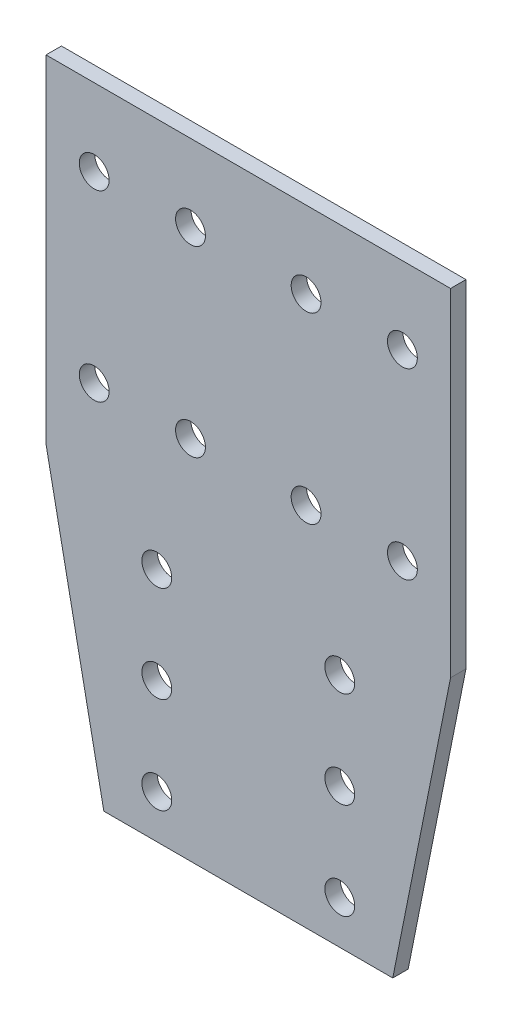
from build123d import *

# Parameters (mm, degrees)
SKETCH_1_R      = 15.5
EXTRUDE_1_DEPTH = 16


with BuildPart() as part:
    # 草图1 → 拉伸1 (new body)
    with BuildSketch(Plane.XY):
        Polygon((380.780090503, 350), (-39.219909497, 350), (-39.219909497, 0), (20.780090503, -300), (320.780090503, -300), (380.780090503, 0), align=None)
        with Locations((75.780090503, -255)):
            Circle(SKETCH_1_R, mode=Mode.SUBTRACT)
        with Locations((75.780090503, -55)):
            Circle(SKETCH_1_R, mode=Mode.SUBTRACT)
        with Locations((75.780090503, -155)):
            Circle(SKETCH_1_R, mode=Mode.SUBTRACT)
        with Locations((110.780090503, 80)):
            Circle(SKETCH_1_R, mode=Mode.SUBTRACT)
        with Locations((10.780090503, 80)):
            Circle(SKETCH_1_R, mode=Mode.SUBTRACT)
        with Locations(Location((110.780090503, 270, 0), (0, 0, 180))):
            Circle(SKETCH_1_R, mode=Mode.SUBTRACT)
        with Locations(Location((10.780090503, 270, 0), (0, 0, 180))):
            Circle(SKETCH_1_R, mode=Mode.SUBTRACT)
        with Locations((330.780090503, 270)):
            Circle(SKETCH_1_R, mode=Mode.SUBTRACT)
        with Locations((230.780090503, 270)):
            Circle(SKETCH_1_R, mode=Mode.SUBTRACT)
        with Locations(Location((330.780090503, 80, 0), (0, 0, 180))):
            Circle(SKETCH_1_R, mode=Mode.SUBTRACT)
        with Locations(Location((230.780090503, 80, 0), (0, 0, 180))):
            Circle(SKETCH_1_R, mode=Mode.SUBTRACT)
        with Locations(Location((265.780090503, -155, 0), (0, 0, 180))):
            Circle(SKETCH_1_R, mode=Mode.SUBTRACT)
        with Locations(Location((265.780090503, -55, 0), (0, 0, 180))):
            Circle(SKETCH_1_R, mode=Mode.SUBTRACT)
        with Locations(Location((265.780090503, -255, 0), (0, 0, 180))):
            Circle(SKETCH_1_R, mode=Mode.SUBTRACT)
    extrude(amount=EXTRUDE_1_DEPTH)


solid = part.part
